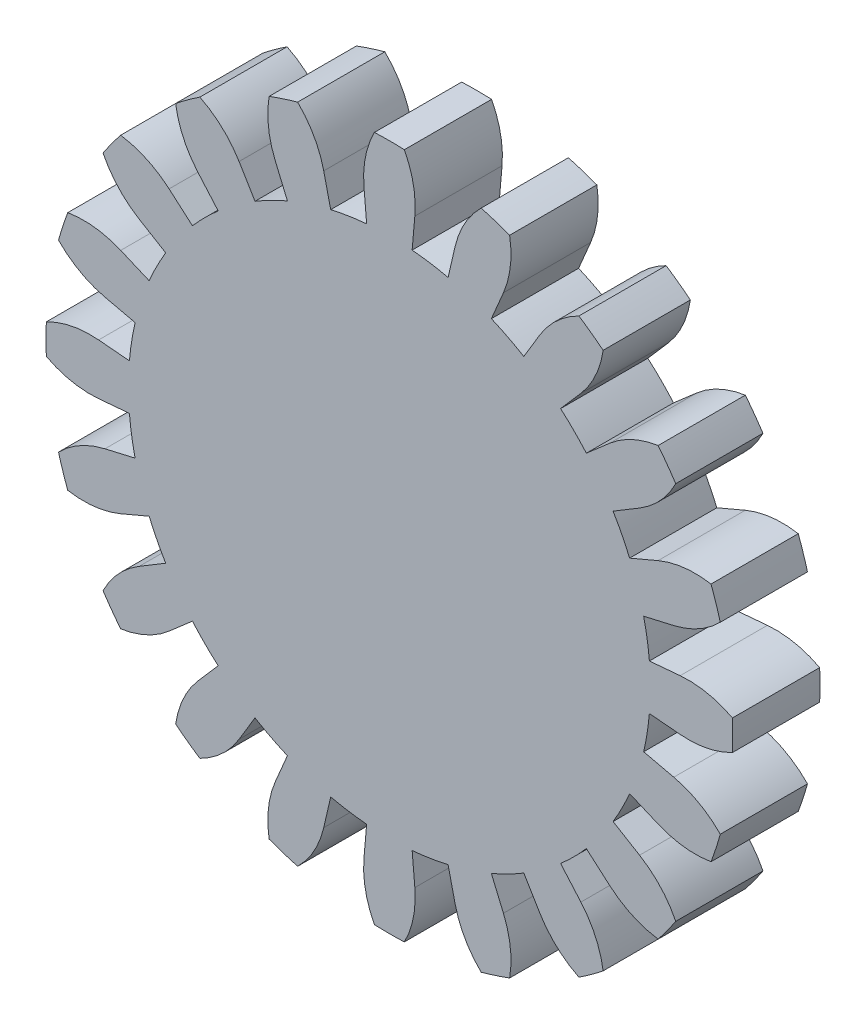
from build123d import *

# Parameters (mm, degrees)
BOSS_EXTRUDE2_DEPTH = 6.35
CIRPATTERN1_COUNT   = 20


with BuildPart() as part:
    # Sketch4 → Boss-Extrude2 (new body)
    with BuildSketch(Plane.XY):
        with BuildLine():
            Line((21.169137334, 1.852059533), (18.927699264, 1.655959112))
            ThreePointArc((18.927699264, 1.655959112), (18.837452366, 2.479997652), (18.711347307, 3.299315376))
            Line((18.711347307, 3.299315376), (0, 0))
            Line((0, 0), (18.711347307, -3.299315376))
            ThreePointArc((18.711347307, -3.299315376), (18.837452366, -2.479997652), (18.927699264, -1.655959112))
            Line((18.927699264, -1.655959112), (21.169137334, -1.852059533))
            ThreePointArc((21.169137334, -1.852059533), (23.12724618, -1.744088061), (24.97620554, -1.090484684))
            ThreePointArc((24.97620554, -1.090484684), (25, 0), (24.97620554, 1.090484684))
            ThreePointArc((24.97620554, 1.090484684), (23.12724618, 1.744088061), (21.169137334, 1.852059533))
        make_face()
    boss_extrude2 = extrude(amount=BOSS_EXTRUDE2_DEPTH)

    # CirPattern1: Boss-Extrude2 ×20 about axis
    cirpattern1_axis = Axis((0, 0, 0), (0, 0, 1))
    for i in range(1, CIRPATTERN1_COUNT):
        add(boss_extrude2.rotate(cirpattern1_axis, i * 360 / CIRPATTERN1_COUNT))


solid = part.part
